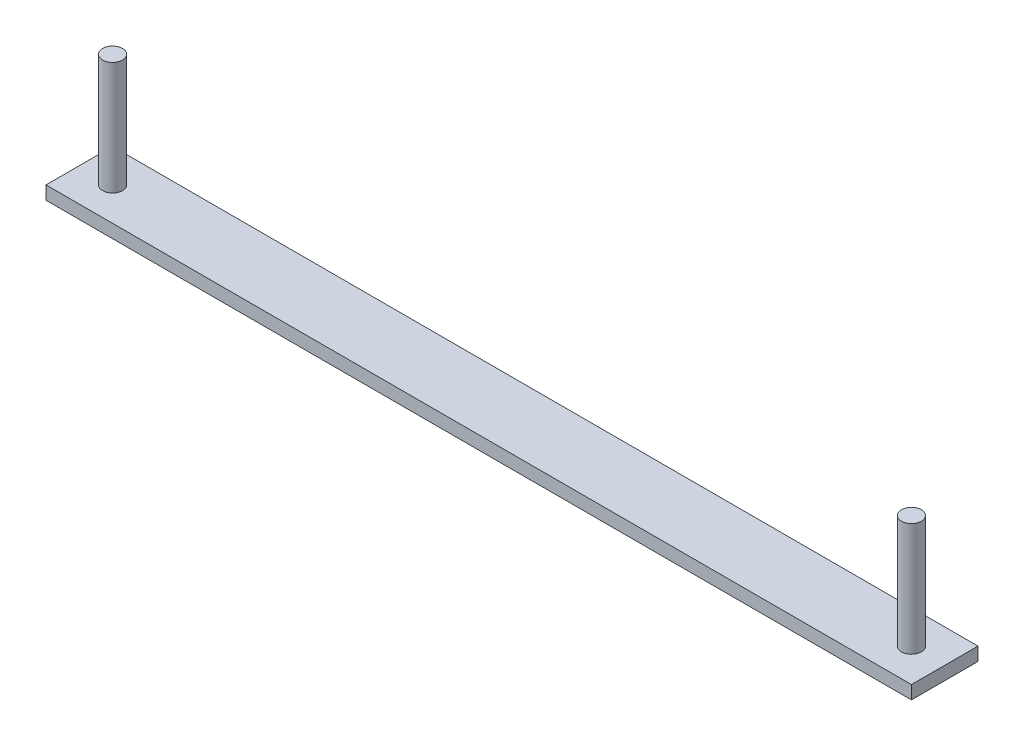
from build123d import *

# Parameters (mm, degrees)
SKETCH3_W           = 130
SKETCH3_H           = 10
BOSS_EXTRUDE1_DEPTH = 2
SKETCH4_R           = 1.5
BOSS_EXTRUDE2_DEPTH = 17


with BuildPart() as part:
    # Sketch3 → Boss-Extrude1 (new body)
    with BuildSketch(Plane(origin=(0, 0, 0), x_dir=(1, 0, 0), z_dir=(0, 1, 0))):
        Rectangle(SKETCH3_W, SKETCH3_H)
    extrude(amount=BOSS_EXTRUDE1_DEPTH)

    # Sketch4 → Boss-Extrude2 (add)
    with BuildSketch(Plane(origin=(0, 2, 0), x_dir=(1, 0, 0), z_dir=(0, 1, 0))):
        with Locations(Location((-60, 0, 0), (0, 0, 90))):
            Circle(SKETCH4_R)
    boss_extrude2 = extrude(amount=BOSS_EXTRUDE2_DEPTH)

    # Mirror1: Boss-Extrude2 across plane
    add(boss_extrude2.mirror(Plane.ZY))


solid = part.part
